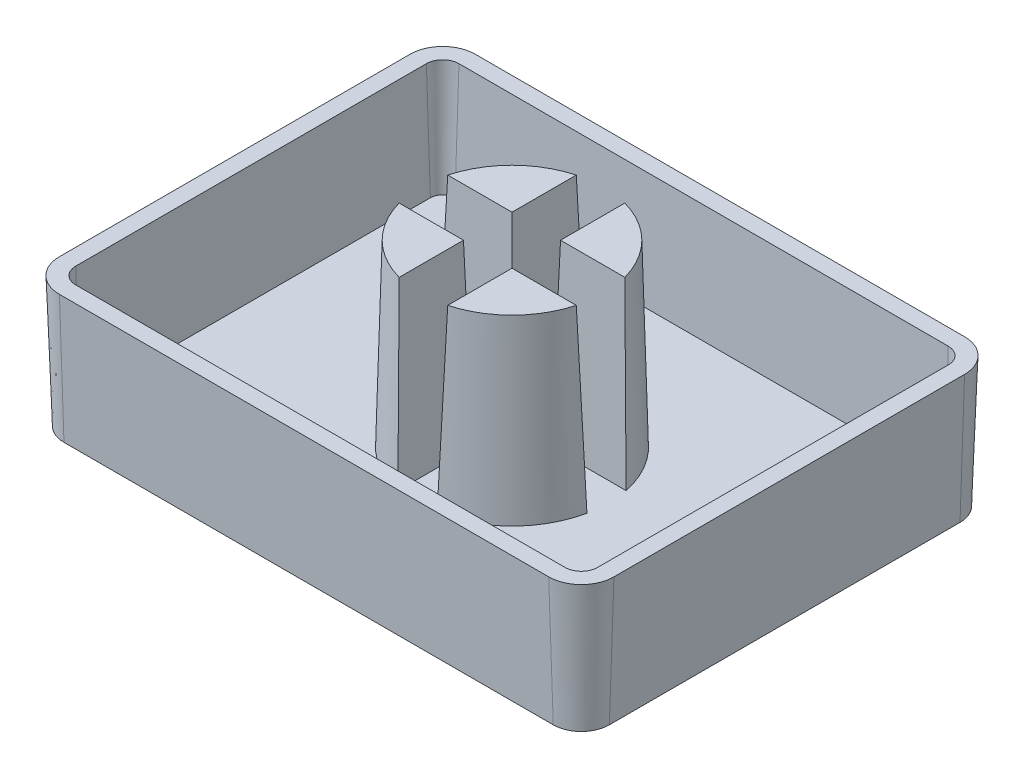
from build123d import *

# Parameters (mm, degrees)
BOSS_EXTRUDE1_DEPTH           = 4
BOSS_EXTRUDE1_DRAFT           = -2
SHELL1_T                      = -0.5
BOSS_EXTRUDE2_DEPTH           = 5.5
BOSS_EXTRUDE2_DRAFT           = 1.5
BOSS_EXTRUDE2_PROFILE_2_DEPTH = 5.5
BOSS_EXTRUDE2_PROFILE_2_DRAFT = 1.5
BOSS_EXTRUDE2_PROFILE_3_DEPTH = 5.5
BOSS_EXTRUDE2_PROFILE_3_DRAFT = 1.5
BOSS_EXTRUDE2_PROFILE_4_DEPTH = 5.5
BOSS_EXTRUDE2_PROFILE_4_DRAFT = 1.5


with BuildPart() as part:
    # Sketch1 → Boss-Extrude1 (with draft: the straight prism first)
    with BuildSketch(Plane(origin=(0, 0, 0), x_dir=(1, 0, 0), z_dir=(0, 1, 0))):
        with BuildLine():
            Line((-7.5, -6.375), (7.5, -6.375))
            ThreePointArc((7.5, -6.375), (8.207106781, -6.082106781), (8.5, -5.375))
            Line((8.5, -5.375), (8.5, 5.375))
            ThreePointArc((8.5, 5.375), (8.207106781, 6.082106781), (7.5, 6.375))
            Line((7.5, 6.375), (-7.5, 6.375))
            ThreePointArc((-7.5, 6.375), (-8.207106781, 6.082106781), (-8.5, 5.375))
            Line((-8.5, 5.375), (-8.5, -5.375))
            ThreePointArc((-8.5, -5.375), (-8.207106781, -6.082106781), (-7.5, -6.375))
        make_face()
    extrude(amount=-BOSS_EXTRUDE1_DEPTH)
    # Boss-Extrude1: the draft: its side faces are tilted about the plane it starts from
    boss_extrude1_sides = [part.faces().sort_by_distance(p)[0] for p in [
        (0, -2, 6.375),
        (8.207106781, -2, 6.082106781),
        (8.5, -2, 0),
        (8.207106781, -2, -6.082106781),
        (0, -2, -6.375),
        (-8.207106781, -2, -6.082106781),
        (-8.5, -2, 0),
        (-8.207106781, -2, 6.082106781),
    ]]
    draft(boss_extrude1_sides, Plane(origin=(0, 0, 0), x_dir=(1, 0, 0), z_dir=(0, 1, 0)), BOSS_EXTRUDE1_DRAFT)

    # Shell1
    shell1_openings = [part.faces().sort_by_distance(p)[0] for p in [
        (0, 0, 0),
    ]]
    offset(amount=SHELL1_T, openings=shell1_openings, kind=Kind.INTERSECTION)


with BuildPart() as boss_extrude2_tool:
    # Sketch3 → Boss-Extrude2 (with draft: the straight prism first)
    with BuildSketch(Plane(origin=(0, -3.5, 0), x_dir=(1, 0, 0), z_dir=(0, 1, 0))):
        with BuildLine():
            ThreePointArc((-0.6, 2.897704648), (-2.092449787, 2.092449787), (-2.897704648, 0.6))
            Line((-2.897704648, 0.6), (-0.6, 0.6))
            Line((-0.6, 0.6), (-0.6, 2.897704648))
        make_face()
    extrude(amount=BOSS_EXTRUDE2_DEPTH)
    # Boss-Extrude2: the draft: its side faces are tilted about the plane it starts from
    boss_extrude2_sides = [boss_extrude2_tool.faces().sort_by_distance(p)[0] for p in [
        (-2.092449787, -0.75, -2.092449787),
        (-1.748852324, -0.75, -0.6),
        (-0.6, -0.75, -1.748852324),
    ]]
    draft(boss_extrude2_sides, Plane(origin=(0, -3.5, 0), x_dir=(1, 0, 0), z_dir=(0, 1, 0)), BOSS_EXTRUDE2_DRAFT)


with BuildPart() as part_1:
    add(part.part)

    # Boss-Extrude2: add boss_extrude2_tool
    add(boss_extrude2_tool.part)


with BuildPart() as boss_extrude2_profile_2_tool:
    # Sketch3 → Boss-Extrude2 profile 2 (with draft: the straight prism first)
    with BuildSketch(Plane(origin=(0, -3.5, 0), x_dir=(1, 0, 0), z_dir=(0, 1, 0))):
        with BuildLine():
            Line((0.6, 2.897704648), (0.6, 0.6))
            Line((0.6, 0.6), (2.897704648, 0.6))
            ThreePointArc((2.897704648, 0.6), (2.092449787, 2.092449787), (0.6, 2.897704648))
        make_face()
    extrude(amount=BOSS_EXTRUDE2_PROFILE_2_DEPTH)
    # Boss-Extrude2 profile 2: the draft: its side faces are tilted about the plane it starts from
    boss_extrude2_profile_2_sides = [boss_extrude2_profile_2_tool.faces().sort_by_distance(p)[0] for p in [
        (2.092449787, -0.75, -2.092449787),
        (0.6, -0.75, -1.748852324),
        (1.748852324, -0.75, -0.6),
    ]]
    draft(boss_extrude2_profile_2_sides, Plane(origin=(0, -3.5, 0), x_dir=(1, 0, 0), z_dir=(0, 1, 0)), BOSS_EXTRUDE2_PROFILE_2_DRAFT)


with BuildPart() as part_2:
    add(part_1.part)

    # Boss-Extrude2 profile 2: add boss_extrude2_profile_2_tool
    add(boss_extrude2_profile_2_tool.part)


with BuildPart() as boss_extrude2_profile_3_tool:
    # Sketch3 → Boss-Extrude2 profile 3 (with draft: the straight prism first)
    with BuildSketch(Plane(origin=(0, -3.5, 0), x_dir=(1, 0, 0), z_dir=(0, 1, 0))):
        with BuildLine():
            ThreePointArc((-2.897704648, -0.6), (-2.092449787, -2.092449787), (-0.6, -2.897704648))
            Line((-0.6, -2.897704648), (-0.6, -0.6))
            Line((-0.6, -0.6), (-2.897704648, -0.6))
        make_face()
    extrude(amount=BOSS_EXTRUDE2_PROFILE_3_DEPTH)
    # Boss-Extrude2 profile 3: the draft: its side faces are tilted about the plane it starts from
    boss_extrude2_profile_3_sides = [boss_extrude2_profile_3_tool.faces().sort_by_distance(p)[0] for p in [
        (-2.092449787, -0.75, 2.092449787),
        (-0.6, -0.75, 1.748852324),
        (-1.748852324, -0.75, 0.6),
    ]]
    draft(boss_extrude2_profile_3_sides, Plane(origin=(0, -3.5, 0), x_dir=(1, 0, 0), z_dir=(0, 1, 0)), BOSS_EXTRUDE2_PROFILE_3_DRAFT)


with BuildPart() as part_3:
    add(part_2.part)

    # Boss-Extrude2 profile 3: add boss_extrude2_profile_3_tool
    add(boss_extrude2_profile_3_tool.part)


with BuildPart() as boss_extrude2_profile_4_tool:
    # Sketch3 → Boss-Extrude2 profile 4 (with draft: the straight prism first)
    with BuildSketch(Plane(origin=(0, -3.5, 0), x_dir=(1, 0, 0), z_dir=(0, 1, 0))):
        with BuildLine():
            Line((0.6, -0.6), (0.6, -2.897704648))
            ThreePointArc((0.6, -2.897704648), (2.092449787, -2.092449787), (2.897704648, -0.6))
            Line((2.897704648, -0.6), (0.6, -0.6))
        make_face()
    extrude(amount=BOSS_EXTRUDE2_PROFILE_4_DEPTH)
    # Boss-Extrude2 profile 4: the draft: its side faces are tilted about the plane it starts from
    boss_extrude2_profile_4_sides = [boss_extrude2_profile_4_tool.faces().sort_by_distance(p)[0] for p in [
        (1.748852324, -0.75, 0.6),
        (0.6, -0.75, 1.748852324),
        (2.092449787, -0.75, 2.092449787),
    ]]
    draft(boss_extrude2_profile_4_sides, Plane(origin=(0, -3.5, 0), x_dir=(1, 0, 0), z_dir=(0, 1, 0)), BOSS_EXTRUDE2_PROFILE_4_DRAFT)


with BuildPart() as part_4:
    add(part_3.part)

    # Boss-Extrude2 profile 4: add boss_extrude2_profile_4_tool
    add(boss_extrude2_profile_4_tool.part)


solid = part_4.part
